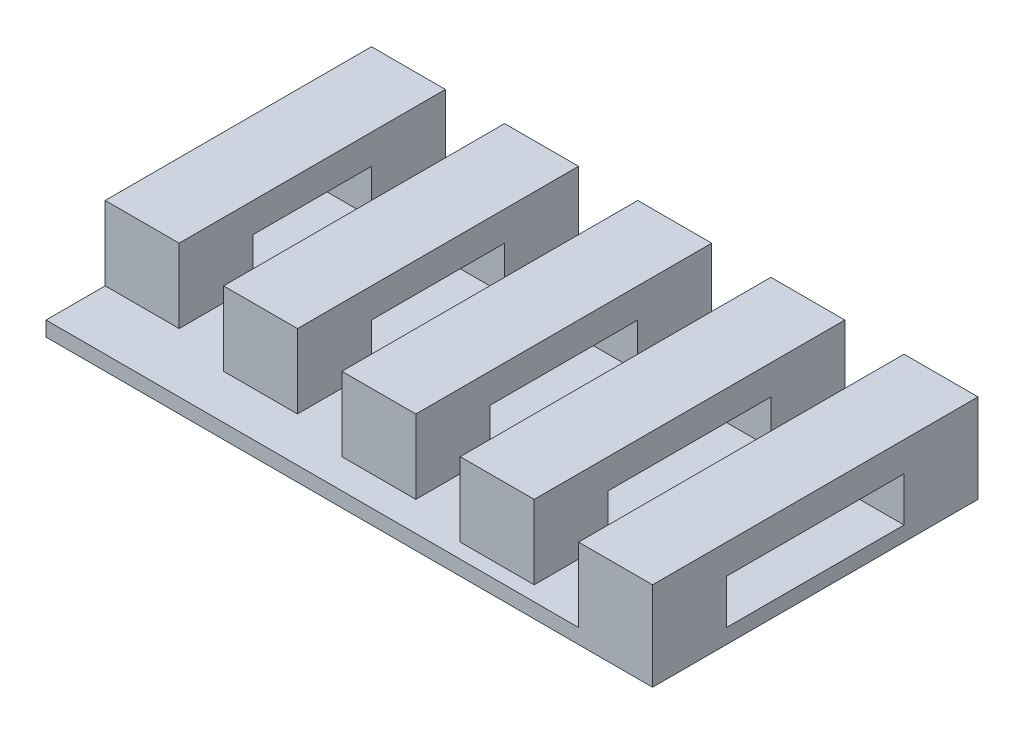
from build123d import *

# Parameters (mm, degrees)
SKETCH1_W            = 41
SKETCH1_H            = 22
BASE_DEPTH           = 1
SKETCH2_W            = 5
SKETCH2_H            = 5
LEGS_EXTRUSION_DEPTH = 5
SKETCH3_W            = 5
SKETCH3_H            = 2
BRIDGE1_DEPTH        = 8
SKETCH4_W            = 5
SKETCH4_H            = 2
BRIDGE2_DEPTH        = 9
SKETCH6_W            = 5
SKETCH6_H            = 2
BRIDGE3_DEPTH        = 10
SKETCH7_W            = 5
SKETCH7_H            = 2
BRIDGE4_DEPTH        = 11
SKETCH8_W            = 5
SKETCH8_H            = 2
BRIDGE5_DEPTH        = 12


with BuildPart() as part:
    # Sketch1 → Base (new body)
    with BuildSketch(Plane(origin=(0, 0, 0), x_dir=(1, 0, 0), z_dir=(0, 1, 0))):
        with Locations((20.5, 11)):
            Rectangle(SKETCH1_W, SKETCH1_H)
    extrude(amount=BASE_DEPTH)

    # Sketch2 → Legs_Extrusion (add)
    with BuildSketch(Plane(origin=(0, 1, 0), x_dir=(1, 0, 0), z_dir=(0, 1, 0))):
        with Locations((2.5, 19.5)):
            Rectangle(SKETCH2_W, SKETCH2_H)
        with Locations((2.5, 6.5)):
            Rectangle(SKETCH2_W, SKETCH2_H)
        with Locations((38.5, 2.5)):
            Rectangle(SKETCH2_W, SKETCH2_H)
        with Locations((38.5, 19.5)):
            Rectangle(SKETCH2_W, SKETCH2_H)
        with Locations((11.5, 19.5)):
            Rectangle(SKETCH2_W, SKETCH2_H)
        with Locations((11.5, 5.5)):
            Rectangle(SKETCH2_W, SKETCH2_H)
        with Locations((20.5, 19.5)):
            Rectangle(SKETCH2_W, SKETCH2_H)
        with Locations((29.5, 19.5)):
            Rectangle(SKETCH2_W, SKETCH2_H)
        with Locations((20.5, 4.5)):
            Rectangle(SKETCH2_W, SKETCH2_H)
        with Locations((29.5, 3.5)):
            Rectangle(SKETCH2_W, SKETCH2_H)
    extrude(amount=LEGS_EXTRUSION_DEPTH)

    # Sketch3 → bridge1 (add)
    with BuildSketch(Plane.XY.offset(-17)):
        with Locations((2.5, 5)):
            Rectangle(SKETCH3_W, SKETCH3_H)
    extrude(amount=BRIDGE1_DEPTH)

    # Sketch4 → bridge2 (add)
    with BuildSketch(Plane.XY.offset(-17)):
        with Locations((11.5, 5)):
            Rectangle(SKETCH4_W, SKETCH4_H)
    extrude(amount=BRIDGE2_DEPTH)

    # Sketch6 → bridge3 (add)
    with BuildSketch(Plane.XY.offset(-17)):
        with Locations((20.5, 5)):
            Rectangle(SKETCH6_W, SKETCH6_H)
    extrude(amount=BRIDGE3_DEPTH)

    # Sketch7 → bridge4 (add)
    with BuildSketch(Plane.XY.offset(-17)):
        with Locations((29.5, 5)):
            Rectangle(SKETCH7_W, SKETCH7_H)
    extrude(amount=BRIDGE4_DEPTH)

    # Sketch8 → bridge5 (add)
    with BuildSketch(Plane.XY.offset(-17)):
        with Locations((38.5, 5)):
            Rectangle(SKETCH8_W, SKETCH8_H)
    extrude(amount=BRIDGE5_DEPTH)


solid = part.part
